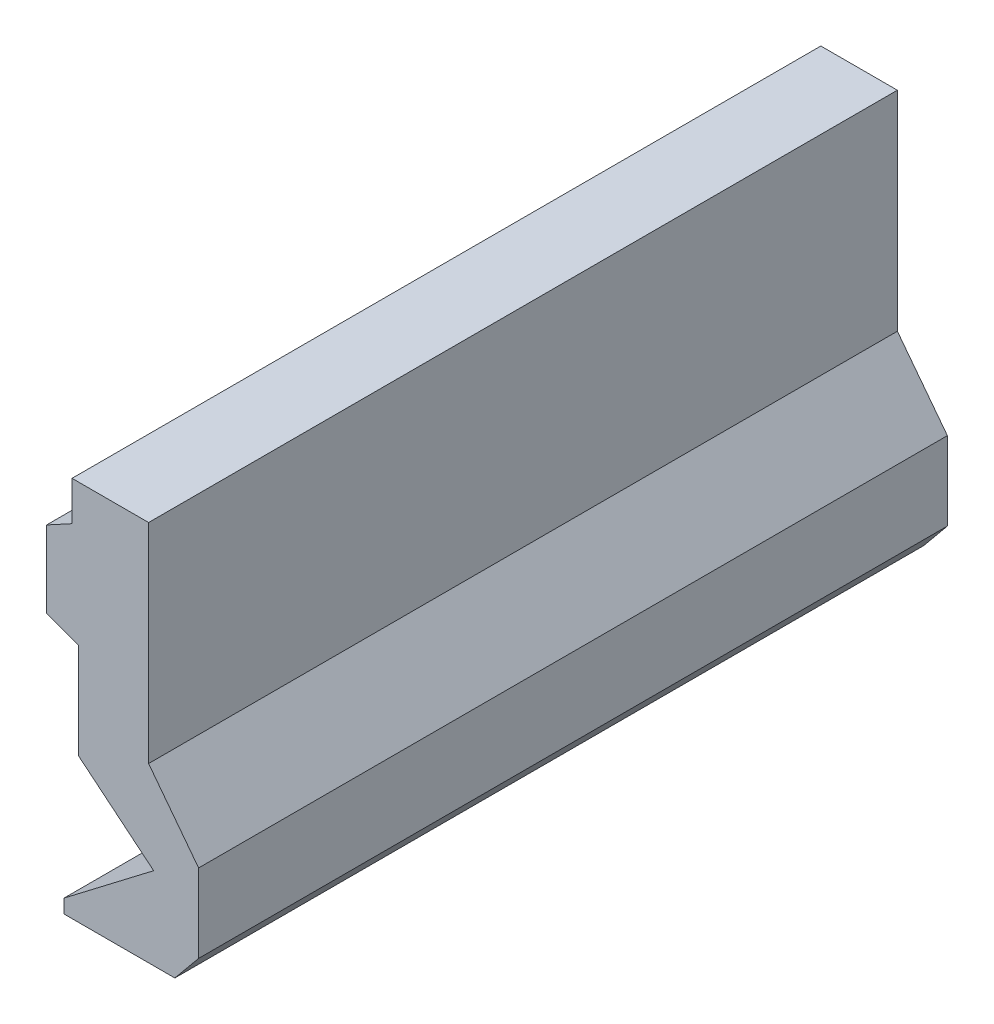
from build123d import *

# Parameters (mm, degrees)
EXTRUDE_1_DEPTH = 30


with BuildPart() as part:
    # 스케치2 → 보스-돌출1 (new body)
    with BuildSketch(Plane.XY):
        Polygon((0.161138111, -2.12747919), (0.161138111, -5.199307457), (1.439620666, -5.669447658), (1.439620666, -9.50021389), (4.450349738, -11.980114421), (0.860040821, -14.724761402), (0.860040821, -15.278827125), (5.29850619, -15.278827125), (6.250768845, -14.122730409), (6.250768845, -10.984026922), (4.247315226, -8.363282816), (4.247315226, 0), (1.180051005, 0), (1.180051005, -1.574205289), align=None)
    extrude(amount=EXTRUDE_1_DEPTH)


solid = part.part
